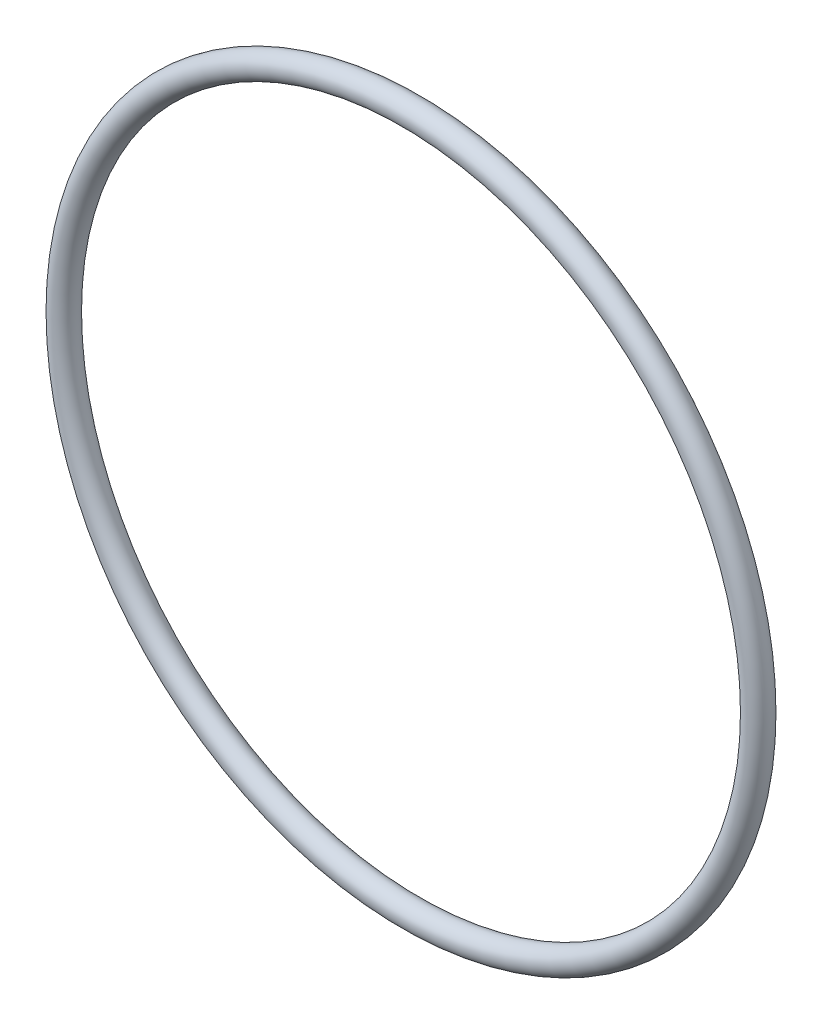
from build123d import *

# Parameters (mm, degrees)
SKETCH1_R = 0.889


with BuildPart() as part:
    # Sketch1 → Revolve1 (revolve)
    with BuildSketch(Plane(origin=(0, 0, 0), x_dir=(0, -1, 0), z_dir=(1, 0, 0)), mode=Mode.PRIVATE) as revolve1_sk:
        with Locations((24.5618, 0)):
            Circle(SKETCH1_R)
    revolve(revolve1_sk.sketch.rotate(Axis((0, 0, 0.889), (0, 0, -1)), 270), axis=Axis((0, 0, 0.889), (0, 0, -1)))


solid = part.part
